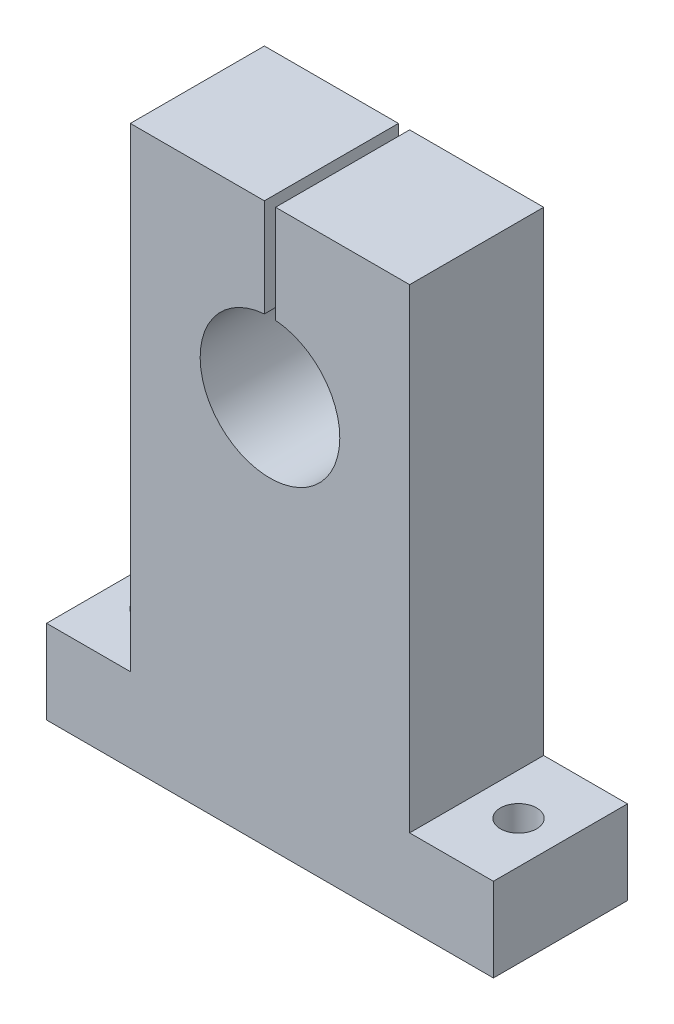
from build123d import *

# Parameters (mm, degrees)
EXTRUDE_1_DEPTH     = 12
SKETCH_2_R          = 3.25
CUT_EXTRUDE_1_DEPTH = 95.704804524


with BuildPart() as part:
    # Эскиз1 → Бобышка-Вытянуть1 (new, symmetric)
    with BuildSketch(Plane.XY):
        with BuildLine():
            Line((-40, -70), (40, -70))
            Line((40, -70), (40, -55))
            Line((40, -55), (25, -55))
            Line((25, -55), (25, 30))
            Line((25, 30), (1, 30))
            Line((1, 30), (1, 12.459935794))
            ThreePointArc((1, 12.459935794), (0, -12.5), (-1, 12.459935794))
            Line((-1, 12.459935794), (-1, 30))
            Line((-1, 30), (-25, 30))
            Line((-25, 30), (-25, -55))
            Line((-25, -55), (-40, -55))
            Line((-40, -55), (-40, -70))
        make_face()
    extrude(amount=EXTRUDE_1_DEPTH, both=True)

    # Эскиз2 → Вырез-Вытянуть1 (cut, through all)
    with BuildSketch(Plane(origin=(0, -55, 0), x_dir=(1, 0, 0), z_dir=(0, 1, 0))):
        with Locations((-32.5, 0)):
            Circle(SKETCH_2_R)
        with Locations((32.5, 0)):
            Circle(SKETCH_2_R)
    extrude(amount=-CUT_EXTRUDE_1_DEPTH, mode=Mode.SUBTRACT)


solid = part.part
